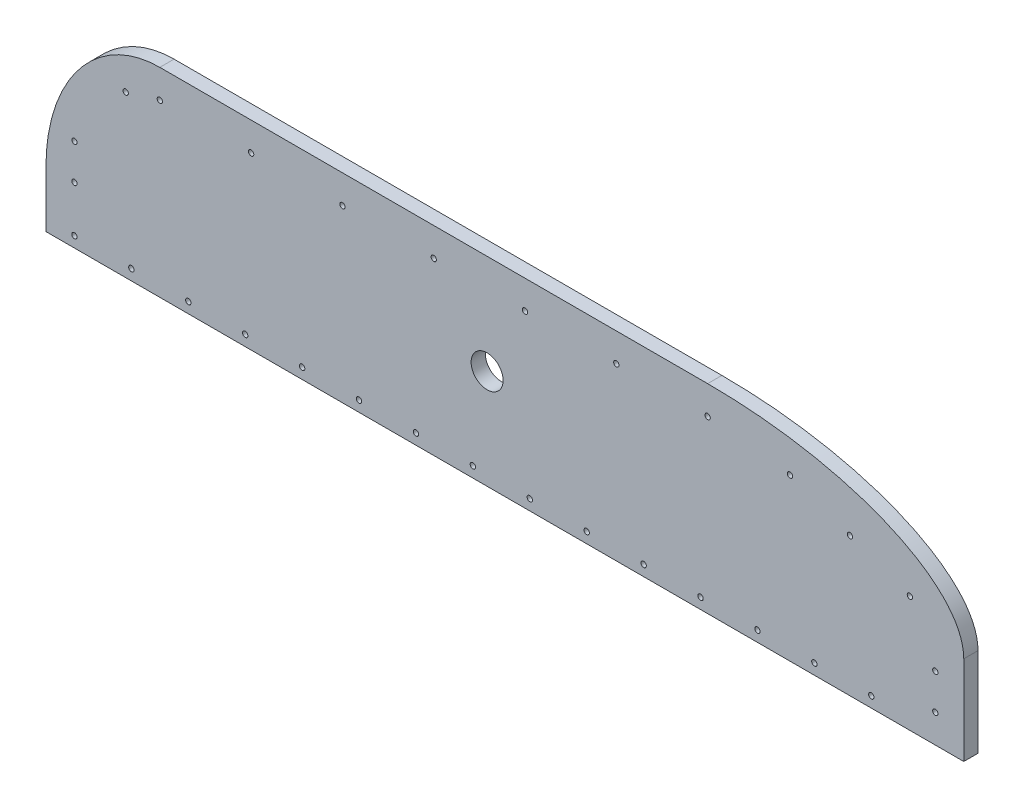
from build123d import *

# Parameters (mm, degrees)
BOSS_EXTRUDE1_DEPTH = 12.7
SKETCH12_R          = 2.38125
CUT_EXTRUDE10_DEPTH = 839.320256645
SKETCH13_R          = 2.413
CUT_EXTRUDE11_DEPTH = 839.320256645
LPATTERN1_COUNT     = 15
LPATTERN1_PITCH     = 50.8
SKETCH17_R          = 14.2875
CUT_EXTRUDE15_DEPTH = 839.320256645


with BuildPart() as part:
    # Sketch1 → Boss-Extrude1 (new body)
    with BuildSketch(Plane.XY):
        with BuildLine():
            Line((0, 0), (819.15, 0))
            Line((819.15, 0), (819.15, 79.375))
            add(Edge.make_bspline(
                [(819.15, 79.375), (819.15, 177.8), (590.55, 177.8)],
                knots=[0, 0, 0, 1.570796327, 1.570796327, 1.570796327], degree=2, weights=[1, 0.707106781, 1]))
            Line((590.55, 177.8), (101.6, 177.8))
            add(Edge.make_bspline(
                [(101.6, 177.8), (0, 177.8), (0, 50.8)],
                knots=[3.141592654, 3.141592654, 3.141592654, 4.71238898, 4.71238898, 4.71238898], degree=2, weights=[1, 0.707106781, 1]))
            Line((0, 50.8), (0, 0))
        make_face()
    extrude(amount=BOSS_EXTRUDE1_DEPTH)

    # Sketch12 → Cut-Extrude10 (cut, through all)
    with BuildSketch(Plane.XY.offset(12.7)):
        with Locations((25.4, 50.8)):
            Circle(SKETCH12_R)
        with Locations((346.075, 152.4)):
            Circle(SKETCH12_R)
        with Locations((264.583333333, 152.4)):
            Circle(SKETCH12_R)
        with Locations((101.6, 152.4)):
            Circle(SKETCH12_R)
        with Locations((183.091666667, 152.4)):
            Circle(SKETCH12_R)
        with Locations((71.12, 143.51)):
            Circle(SKETCH12_R)
        with Locations((25.4, 82.55)):
            Circle(SKETCH12_R)
        with Locations((509.058333333, 152.4)):
            Circle(SKETCH12_R)
        with Locations((590.55, 152.4)):
            Circle(SKETCH12_R)
        with Locations((427.566666667, 152.4)):
            Circle(SKETCH12_R)
        with Locations((793.75, 57.15)):
            Circle(SKETCH12_R)
        with Locations((793.75, 25.4)):
            Circle(SKETCH12_R)
        with Locations((717.55, 123.825)):
            Circle(SKETCH12_R)
        with Locations((664.038787502, 143.891704687)):
            Circle(SKETCH12_R)
        with Locations((771.061212498, 103.758295313)):
            Circle(SKETCH12_R)
    extrude(amount=-CUT_EXTRUDE10_DEPTH, mode=Mode.SUBTRACT)

    # Sketch13 → Cut-Extrude11 (cut, through all)
    with BuildSketch(Plane.XY.offset(12.7)):
        with Locations((25.4, 9.525)):
            Circle(SKETCH13_R)
    cut_extrude11 = extrude(amount=-CUT_EXTRUDE11_DEPTH, mode=Mode.SUBTRACT)

    # LPattern1: Cut-Extrude11 ×15
    with Locations(*[(i * LPATTERN1_PITCH, 0, 0) for i in range(1, LPATTERN1_COUNT)]):
        add(cut_extrude11, mode=Mode.SUBTRACT)

    # Sketch17 → Cut-Extrude15 (cut, through all)
    with BuildSketch(Plane.XY.offset(12.7)):
        with Locations((393.7, 88.9)):
            Circle(SKETCH17_R)
    extrude(amount=-CUT_EXTRUDE15_DEPTH, mode=Mode.SUBTRACT)


solid = part.part
